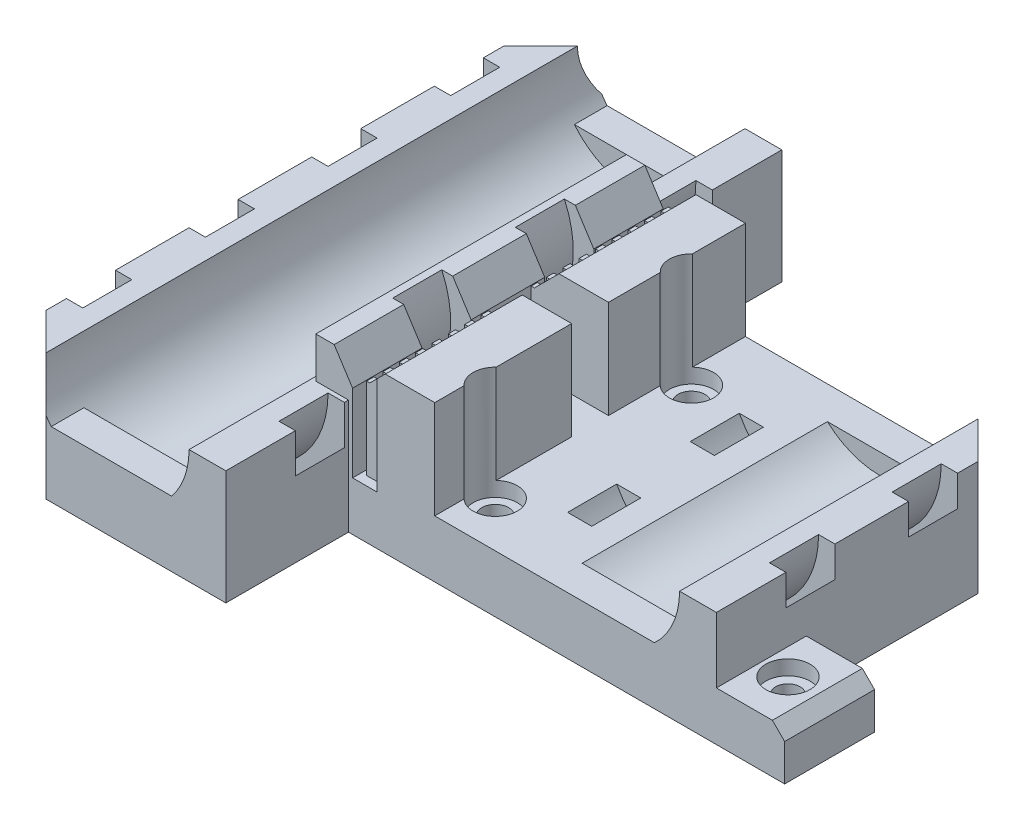
from build123d import *

# Parameters (mm, degrees)
SKETCH1_R           = 1.65
SKETCH1_R_2         = 1.5
BOSS_EXTRUDE1_DEPTH = 19
SKETCH2_W           = 28
SKETCH2_H           = 68
CUT_EXTRUDE1_DEPTH  = 5
SKETCH3_R           = 9.5
CUT_EXTRUDE2_DEPTH  = 79.787630581
SKETCH4_W           = 28
SKETCH4_H           = 4
BOSS_EXTRUDE3_DEPTH = 8
SKETCH5_W           = 2.8
SKETCH5_H           = 6
SKETCH7_W           = 4
SKETCH7_H           = 38
BOSS_EXTRUDE4_DEPTH = 5
SKETCH8_W           = 0.6
SKETCH8_H           = 38
CUT_EXTRUDE3_DEPTH  = 13
LPATTERN1_COUNT     = 4
LPATTERN1_PITCH     = 15
CUT_EXTRUDE4_DEPTH  = 54
SKETCH11_R          = 9.5
CUT_EXTRUDE6_DEPTH  = 75
SKETCH12_W          = 20.45
SKETCH12_H          = 38
CUT_EXTRUDE7_DEPTH  = 12
SKETCH14_W          = 14.272252789
SKETCH14_H          = 38
CUT_EXTRUDE9_DEPTH  = 5
SKETCH15_W          = 8.35
SKETCH15_H          = 11
CUT_EXTRUDE10_DEPTH = 8
SKETCH16_W          = 28.394140708
SKETCH16_H          = 4
SKETCH16_W_2        = 23.667282337
BOSS_EXTRUDE5_DEPTH = 7
SKETCH17_W          = 2.5
SKETCH17_H          = 6
LPATTERN2_COUNT     = 2
LPATTERN2_PITCH     = 15
SKETCH18_R          = 2.7
CUT_EXTRUDE11_DEPTH = 1.8
CUT_EXTRUDE12_START = 12
SKETCH19_R          = 2.7
CUT_EXTRUDE12_DEPTH = 13.8
SKETCH20_W          = 2.4
SKETCH20_H          = 1.11
CUT_EXTRUDE13_DEPTH = 13
LPATTERN3_COUNT     = 20
LPATTERN3_PITCH     = 2
CUT_EXTRUDE15_START = -19
SKETCH23_W          = 9.640158514
SKETCH23_H          = 12
CUT_EXTRUDE15_DEPTH = 2.25
CHAMFER2_SIZE       = 1.5
CHAMFER3_SIZE       = 6
CUT_EXTRUDE16_DEPTH = 56


with BuildPart() as part:
    # Sketch1 → Boss-Extrude1 (new body)
    with BuildSketch(Plane(origin=(0, 0, 0), x_dir=(1, 0, 0), z_dir=(0, 1, 0))):
        Polygon((0.38789484, -8.215418094), (0.38789484, 6.784581906), (53.73789484, 6.784581906), (53.73789484, 17.784581906), (45.38789484, 17.784581906), (45.38789484, 44.784581906), (0.38789484, 44.784581906), (0.38789484, 59.784581906), (-27.61210516, 59.784581906), (-27.61210516, -8.215418094), align=None)
        with Locations(Location((12.78789484, 36.334581906, 0), (0, 0, 270))):
            Circle(SKETCH1_R, mode=Mode.SUBTRACT)
        with Locations(Location((12.78789484, 12.334581906, 0), (0, 0, 270))):
            Circle(SKETCH1_R, mode=Mode.SUBTRACT)
        with Locations(Location((48.58789484, 12.334581906, 0), (0, 0, 270))):
            Circle(SKETCH1_R_2, mode=Mode.SUBTRACT)
    extrude(amount=BOSS_EXTRUDE1_DEPTH)

    # Sketch2 → Cut-Extrude1 (cut)
    with BuildSketch(Plane(origin=(0, 19, 0), x_dir=(1, 0, 0), z_dir=(0, 1, 0))):
        with Locations((-13.61210516, 25.784581906)):
            Rectangle(SKETCH2_W, SKETCH2_H)
    extrude(amount=-CUT_EXTRUDE1_DEPTH, mode=Mode.SUBTRACT)

    # Sketch3 → Cut-Extrude2 (cut)
    with BuildSketch(Plane.XY.offset(8.215418094)):
        with Locations((-13.61210516, 14)):
            Circle(SKETCH3_R)
    extrude(amount=-CUT_EXTRUDE2_DEPTH, mode=Mode.SUBTRACT)

    # Sketch4 → Boss-Extrude3 (add)
    with BuildSketch(Plane.XZ):
        with Locations((-13.61210516, 6.215418094)):
            Rectangle(SKETCH4_W, SKETCH4_H)
        with Locations((-13.61210516, -57.784581906)):
            Rectangle(SKETCH4_W, SKETCH4_H)
    extrude(amount=-BOSS_EXTRUDE3_DEPTH)

    # Sketch5 → Cut-Revolve2 (revolve, cut)
    with BuildSketch(Plane(origin=(0, 14, 0), x_dir=(1, 0, 0), z_dir=(0, 1, 0))):
        with Locations((-27.01210516, 3.284581906)):
            Rectangle(SKETCH5_W, SKETCH5_H)
    cut_revolve2 = revolve(axis=Axis((-13.61210516, 14, -59.784581906), (0, 0, 1)), mode=Mode.SUBTRACT)

    # Sketch7 → Boss-Extrude4 (add)
    with BuildSketch(Plane(origin=(0, 14, 0), x_dir=(1, 0, 0), z_dir=(0, 1, 0))):
        with Locations((-1.61210516, 25.784581906)):
            Rectangle(SKETCH7_W, SKETCH7_H)
    extrude(amount=BOSS_EXTRUDE4_DEPTH)

    # Sketch8 → Cut-Extrude3 (cut)
    with BuildSketch(Plane(origin=(0, 19, 0), x_dir=(1, 0, 0), z_dir=(0, 1, 0))):
        with Locations((1.18789484, 25.784581906)):
            Rectangle(SKETCH8_W, SKETCH8_H)
    extrude(amount=-CUT_EXTRUDE3_DEPTH, mode=Mode.SUBTRACT)

    # LPattern1: Cut-Revolve2 ×4
    with Locations(*[(0, 0, -i * LPATTERN1_PITCH) for i in range(1, LPATTERN1_COUNT)]):
        add(cut_revolve2, mode=Mode.SUBTRACT)

    # Sketch9 → Cut-Extrude4 (cut)
    with BuildSketch(Plane.XY.offset(-6.784581906)):
        Polygon((0.88789484, 19), (-1.36210516, 19), (0.88789484, 15.5), align=None)
    extrude(amount=-CUT_EXTRUDE4_DEPTH, mode=Mode.SUBTRACT)

    # Sketch11 → Cut-Extrude6 (cut)
    with BuildSketch(Plane.XY.offset(-6.784581906)):
        with Locations((31.38789484, 14)):
            Circle(SKETCH11_R)
    extrude(amount=-CUT_EXTRUDE6_DEPTH, mode=Mode.SUBTRACT)

    # Sketch12 → Cut-Extrude7 (cut)
    with BuildSketch(Plane(origin=(0, 19, 0), x_dir=(1, 0, 0), z_dir=(0, 1, 0))):
        with Locations((21.16289484, 25.784581906)):
            Rectangle(SKETCH12_W, SKETCH12_H)
    extrude(amount=-CUT_EXTRUDE7_DEPTH, mode=Mode.SUBTRACT)

    # Sketch14 → Cut-Extrude9 (cut)
    with BuildSketch(Plane(origin=(0, 19, 0), x_dir=(1, 0, 0), z_dir=(0, 1, 0))):
        with Locations((46.601768445, 25.784581906)):
            Rectangle(SKETCH14_W, SKETCH14_H)
    extrude(amount=-CUT_EXTRUDE9_DEPTH, mode=Mode.SUBTRACT)

    # Sketch15 → Cut-Extrude10 (cut)
    with BuildSketch(Plane(origin=(0, 14, 0), x_dir=(1, 0, 0), z_dir=(0, 1, 0))):
        with Locations((49.56289484, 12.284581906)):
            Rectangle(SKETCH15_W, SKETCH15_H)
    extrude(amount=-CUT_EXTRUDE10_DEPTH, mode=Mode.SUBTRACT)

    # Sketch16 → Boss-Extrude5 (add)
    with BuildSketch(Plane(origin=(0, 0, 0), x_dir=(-1, 0, 0), z_dir=(0, -1, 0))):
        with Locations((-30.406511334, 8.784581906)):
            Rectangle(SKETCH16_W, SKETCH16_H)
        with Locations((-33.554253671, 42.784581906)):
            Rectangle(SKETCH16_W_2, SKETCH16_H)
    extrude(amount=-BOSS_EXTRUDE5_DEPTH)

    # Sketch17 → Cut-Revolve3 (revolve, cut)
    with BuildSketch(Plane(origin=(0, 14, 0), x_dir=(1, 0, 0), z_dir=(0, 1, 0))):
        with Locations((44.63789484, 18.284581906)):
            Rectangle(SKETCH17_W, SKETCH17_H)
    cut_revolve3 = revolve(axis=Axis((31.38789484, 14, -44.784581906), (0, 0, 1)), mode=Mode.SUBTRACT)

    # LPattern2: Cut-Revolve3 ×2
    with Locations(*[(0, 0, -i * LPATTERN2_PITCH) for i in range(1, LPATTERN2_COUNT)]):
        add(cut_revolve3, mode=Mode.SUBTRACT)

    # Sketch18 → Cut-Extrude11 (cut)
    with BuildSketch(Plane(origin=(0, 6, 0), x_dir=(1, 0, 0), z_dir=(0, 1, 0))):
        with Locations(Location((48.58789484, 12.334581906, 0), (0, 0, 270))):
            Circle(SKETCH18_R)
    extrude(amount=-CUT_EXTRUDE11_DEPTH, mode=Mode.SUBTRACT)

    # Sketch19 → Cut-Extrude12 (cut)
    with BuildSketch(Plane(origin=(0, 7, 0), x_dir=(1, 0, 0), z_dir=(0, 1, 0)).offset(CUT_EXTRUDE12_START)):
        with Locations(Location((12.78789484, 36.334581906, 0), (0, 0, 270))):
            Circle(SKETCH19_R)
        with Locations(Location((12.78789484, 12.334581906, 0), (0, 0, 270))):
            Circle(SKETCH19_R)
    extrude(amount=-CUT_EXTRUDE12_DEPTH, mode=Mode.SUBTRACT)

    # Sketch20 → Cut-Extrude13 (cut)
    with BuildSketch(Plane(origin=(0, 19, 0), x_dir=(1, 0, 0), z_dir=(0, 1, 0))):
        with Locations((2.68789484, 43.339581906)):
            Rectangle(SKETCH20_W, SKETCH20_H)
    cut_extrude13 = extrude(amount=-CUT_EXTRUDE13_DEPTH, mode=Mode.SUBTRACT)

    # LPattern3: Cut-Extrude13 ×20
    with Locations(*[(0, 0, i * LPATTERN3_PITCH) for i in range(1, LPATTERN3_COUNT)]):
        add(cut_extrude13, mode=Mode.SUBTRACT)

    # Sketch23 → Cut-Extrude15 (cut, symmetric)
    with BuildSketch(Plane.XY.offset(-6.784581906).offset(CUT_EXTRUDE15_START)):
        with Locations((6.117815583, 13)):
            Rectangle(SKETCH23_W, SKETCH23_H)
    extrude(amount=CUT_EXTRUDE15_DEPTH, both=True, mode=Mode.SUBTRACT)

    # Chamfer2
    chamfer2_edges = [part.edges().sort_by_distance(p)[0] for p in [
        (53.73789484, 6, -12.284581906),
    ]]
    chamfer(chamfer2_edges, length=CHAMFER2_SIZE)

    # Chamfer3
    chamfer3_edges = [part.edges().sort_by_distance(p)[0] for p in [
        (45.38789484, 7, -44.784581906),
        (-27.61210516, 7, -59.784581906),
        (-27.61210516, 7, 8.215418094),
    ]]
    chamfer(chamfer3_edges, length=CHAMFER3_SIZE)

    # Sketch24 → Cut-Extrude16 (cut)
    with BuildSketch(Plane(origin=(0, 0, -44.784581906), x_dir=(-1, 0, 0), z_dir=(0, 0, -1))):
        Polygon((-1.48789484, 19), (-1.48789484, 16), (-1.88789484, 16), (-4.88789484, 19), align=None)
    extrude(amount=-CUT_EXTRUDE16_DEPTH, mode=Mode.SUBTRACT)


solid = part.part
